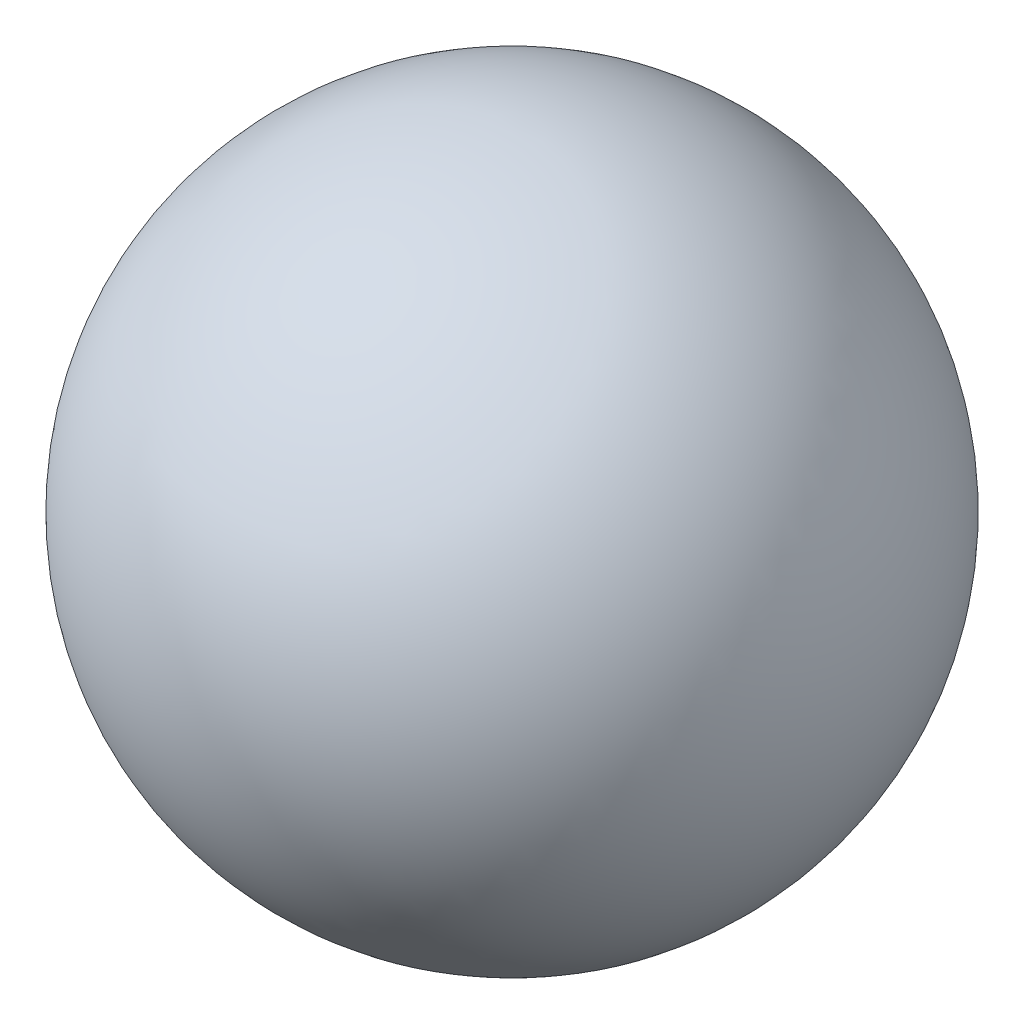
from build123d import *


with BuildPart() as part:
    # Sketch3 → Revolve3 (revolve)
    with BuildSketch(Plane.XY):
        with BuildLine():
            Line((0, 3.5), (0, -3.5))
            ThreePointArc((0, -3.5), (-3.5, 0), (0, 3.5))
        make_face()
    revolve(axis=Axis((0, 3.5, 0), (0, -1, 0)))


solid = part.part
